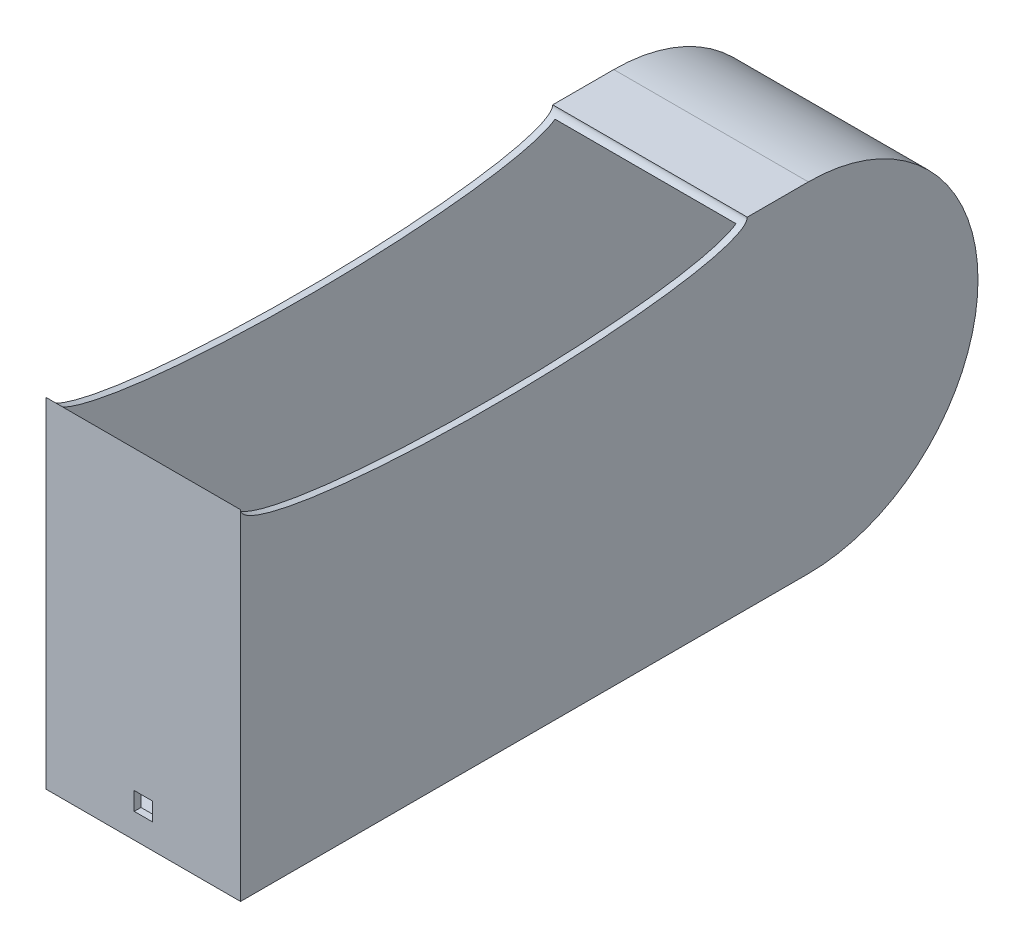
from build123d import *

# Parameters (mm, degrees)
BOSS_EXTRUDE1_DEPTH      = 63.5
BOSS_EXTRUDE1_DEPTH_BACK = 63.5
CUT_EXTRUDE1_REACH       = 573.246
SKETCH4_W                = 12.7
SKETCH4_H                = 12.7
BOSS_EXTRUDE3_DEPTH      = 4.7625
CUT_EXTRUDE2_DEPTH       = 467.787091958
CUT_EXTRUDE2_DEPTH_BACK  = 467.787091958
SKETCH11_RX              = 177.8
SKETCH11_RY              = 25.4


with BuildPart() as part:
    # Sketch2 → Boss-Extrude1 (new, two sides: drawn at the far end of the back side and taken through both)
    with BuildSketch(Plane(origin=(0, 0, 0), x_dir=(0, 0, -1), z_dir=(1, 0, 0)).offset(-BOSS_EXTRUDE1_DEPTH_BACK)):
        with BuildLine():
            Line((0, -4.7625), (-398.4625, -4.7625))
            Line((-398.4625, -4.7625), (-398.4625, 233.3625))
            Line((-398.4625, 233.3625), (0, 233.3625))
            ThreePointArc((0, 233.3625), (119.0625, 114.3), (0, -4.7625))
        make_face()
        with BuildLine():
            Line((0, 0), (-393.7, 0))
            Line((-393.7, 0), (-393.7, 228.6))
            Line((-393.7, 228.6), (0, 228.6))
            ThreePointArc((0, 228.6), (114.3, 114.3), (0, 0))
        make_face(mode=Mode.SUBTRACT)
    extrude(amount=BOSS_EXTRUDE1_DEPTH + BOSS_EXTRUDE1_DEPTH_BACK)

    # Sketch4 → Cut-Extrude1 (cut, up to next)
    with BuildSketch(Plane.XY.offset(398.4625), mode=Mode.PRIVATE) as cut_extrude1_sk1:
        with Locations((0, 19.05)):
            Rectangle(SKETCH4_W, SKETCH4_H)
    cut_extrude1_tool1 = extrude(cut_extrude1_sk1.sketch, amount=-CUT_EXTRUDE1_REACH, mode=Mode.PRIVATE) & part.part
    add(cut_extrude1_tool1.solids().sort_by_distance((0, 19.05, 398.4625))[0], mode=Mode.SUBTRACT)

    # Sketch9 → Boss-Extrude3 (add)
    with BuildSketch(Plane(origin=(63.5, 0, 0), x_dir=(0, 0, -1), z_dir=(1, 0, 0))):
        with BuildLine():
            Line((-398.4625, 233.3625), (0, 233.3625))
            ThreePointArc((0, 233.3625), (119.0625, 114.3), (0, -4.7625))
            Line((0, -4.7625), (-398.4625, -4.7625))
            Line((-398.4625, -4.7625), (-398.4625, 233.3625))
        make_face()
    boss_extrude3 = extrude(amount=BOSS_EXTRUDE3_DEPTH)

    # Mirror1: Boss-Extrude3 across plane
    add(boss_extrude3.mirror(Plane(origin=(0, 0, 0), x_dir=(0, 0, 1), z_dir=(1, 0, 0))))

    # Sketch11 → Cut-Extrude2 (cut, two sides: drawn at the far end of the back side and taken through both)
    with BuildSketch(Plane(origin=(0, 0, 0), x_dir=(0, 0, -1), z_dir=(1, 0, 0)).offset(-CUT_EXTRUDE2_DEPTH_BACK)):
        with Locations(Location((-220.6625, 233.3625), (0, 0, -180))):
            Ellipse(SKETCH11_RX, SKETCH11_RY)
    extrude(amount=CUT_EXTRUDE2_DEPTH + CUT_EXTRUDE2_DEPTH_BACK, mode=Mode.SUBTRACT)


solid = part.part
